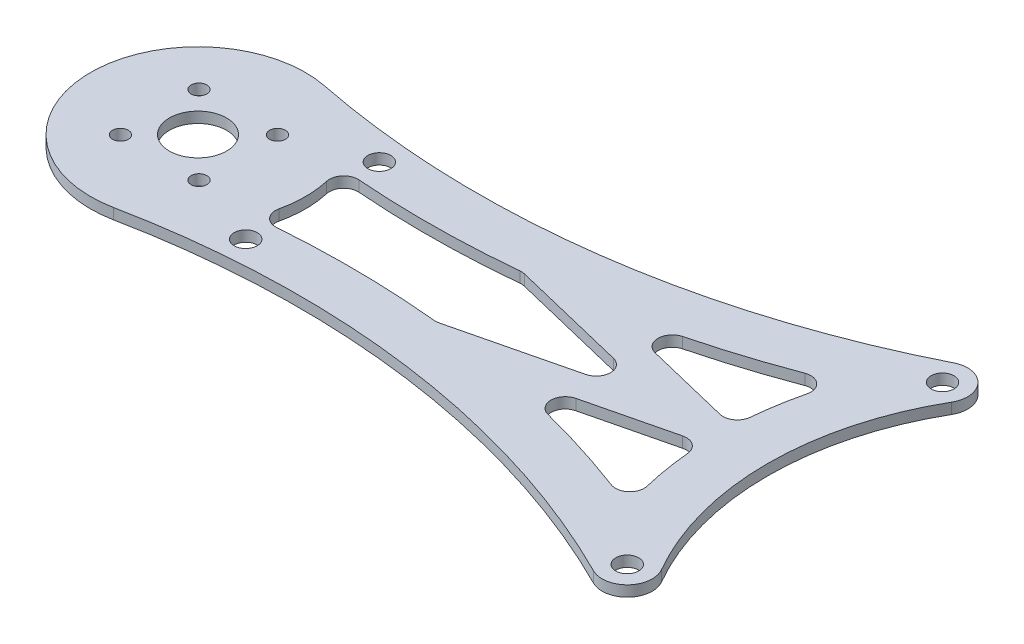
from build123d import *

# Parameters (mm, degrees)
SKETCH1_R                      = 3.5
BOSS_EXTRUDE1_DEPTH            = 0.75
F_2_2_2_2_DIAMETER_HOLE1_D     = 2.2
F_3_2_3_2_DIAMETER_HOLE1_D     = 3.2
F_3_2_3_2_DIAMETER_HOLE1_DEPTH = 10
F_3_2_3_2_DIAMETER_HOLE1_TIP   = 0.96137699
CUT_EXTRUDE1_DEPTH             = 138.395414771
FILLET1_R                      = 2
SKETCH7_R                      = 4
CUT_EXTRUDE2_DEPTH             = 138.395414889


with BuildPart() as part:
    # Sketch1 → Boss-Extrude1 (new, symmetric)
    with BuildSketch(Plane(origin=(0, 0, 0), x_dir=(1, 0, 0), z_dir=(0, 1, 0))):
        with BuildLine():
            ThreePointArc((-41.13620668, -23.75), (-47.5, 0), (-41.13620668, 23.75))
            ThreePointArc((-41.13620668, 23.75), (-40.506696415, 24.5460597), (-39.675258631, 25.128043744))
            ThreePointArc((-39.675258631, 25.128043744), (-77.494729166, 13.448582828), (-117.056517742, 14.708361982))
            ThreePointArc((-117.056517742, 14.708361982), (-135, 0), (-117.056517742, -14.708361982))
            ThreePointArc((-117.056517742, -14.708361982), (-77.494729166, -13.448582828), (-39.675258631, -25.128043744))
            ThreePointArc((-39.675258631, -25.128043744), (-40.506696415, -24.5460597), (-41.13620668, -23.75))
        make_face()
        with BuildLine():
            ThreePointArc((-35.074028853, 20.25), (-39.855117767, 18.968911087), (-41.13620668, 23.75))
            ThreePointArc((-41.13620668, 23.75), (-47.5, 0), (-41.13620668, -23.75))
            ThreePointArc((-41.13620668, -23.75), (-39.855117767, -18.968911087), (-35.074028853, -20.25))
            ThreePointArc((-35.074028853, -20.25), (-40.5, 0), (-35.074028853, 20.25))
        make_face()
        with Locations((-38.105117767, -22)):
            Circle(SKETCH1_R)
        with Locations((-38.105117767, 22)):
            Circle(SKETCH1_R)
    extrude(amount=BOSS_EXTRUDE1_DEPTH, both=True)

    # Ø2.2 (2.2) Diameter Hole1 (through all)
    with Locations(Plane(origin=(0, 0.75, 0), x_dir=(1, 0, 0), z_dir=(0, 1, 0))):
        with Locations((-125.378942435, 5.51463095), (-114.418787327, 5.51463095), (-114.418787327, -5.445524158), (-125.378942435, -5.445524158)):
            Hole(F_2_2_2_2_DIAMETER_HOLE1_D / 2)

    # Ø3.2 (3.2) Diameter Hole1
    with Locations(Plane(origin=(0, 0.75, 0), x_dir=(1, 0, 0), z_dir=(0, 1, 0))):
        with Locations((-38.105117767, 22), (-38.105117767, -22), (-104.021186711, 9.323493222), (-104.021186711, -9.323493222)):
            Hole(F_3_2_3_2_DIAMETER_HOLE1_D / 2, depth=F_3_2_3_2_DIAMETER_HOLE1_DEPTH)
            with Locations((0, 0, -(F_3_2_3_2_DIAMETER_HOLE1_DEPTH + F_3_2_3_2_DIAMETER_HOLE1_TIP / 2))):  # 118° drill point
                Cone(0, F_3_2_3_2_DIAMETER_HOLE1_D / 2, F_3_2_3_2_DIAMETER_HOLE1_TIP, mode=Mode.SUBTRACT)

    # Sketch6 → Cut-Extrude1 (cut, through all)
    with BuildSketch(Plane(origin=(0, 0.75, 0), x_dir=(1, 0, 0), z_dir=(0, 1, 0))):
        with BuildLine():
            Line((-80.72687621, -6.02009961), (-55.965778938, 0))
            Line((-55.965778938, 0), (-80.72687621, 6.02009961))
            ThreePointArc((-80.72687621, 6.02009961), (-93.493210894, 5.375258779), (-106.259702082, 6.016993695))
            ThreePointArc((-106.259702082, 6.016993695), (-105, 0), (-106.259702082, -6.016993695))
            ThreePointArc((-106.259702082, -6.016993695), (-93.493210894, -5.375258779), (-80.72687621, -6.02009961))
        make_face()
        with BuildLine():
            Line((-70.096059807, 7.551982097), (-47.45584926, 2.047528026))
            ThreePointArc((-47.45584926, 2.047528026), (-46.716397825, 8.592332297), (-45.078723321, 14.971930527))
            ThreePointArc((-45.078723321, 14.971930527), (-57.396315368, 10.61771767), (-70.096059807, 7.551982097))
        make_face()
        with BuildLine():
            ThreePointArc((-45.078723321, -14.971930527), (-46.716397825, -8.592332297), (-47.45584926, -2.047528026))
            Line((-47.45584926, -2.047528026), (-70.096059807, -7.551982097))
            ThreePointArc((-70.096059807, -7.551982097), (-57.396315368, -10.61771767), (-45.078723321, -14.971930527))
        make_face()
    extrude(amount=-CUT_EXTRUDE1_DEPTH, mode=Mode.SUBTRACT)

    # Fillet1
    fillet1_edges = [part.edges().sort_by_distance(p)[0] for p in [
        (-47.45584926, 0, 2.047528026),
        (-45.078723321, 0, 14.971930527),
        (-70.096059807, 0, 7.551982097),
        (-106.259702082, 0, 6.016993695),
        (-106.259702082, 0, -6.016993695),
        (-80.72687621, 0, -6.02009961),
        (-55.965778938, 0, 0),
        (-80.72687621, 0, 6.02009961),
        (-45.078723321, 0, -14.971930527),
        (-47.45584926, 0, -2.047528026),
        (-70.096059807, 0, -7.551982097),
    ]]
    fillet(fillet1_edges, radius=FILLET1_R)

    # Sketch7 → Cut-Extrude2 (cut, through all)
    with BuildSketch(Plane(origin=(0, 0.75, 0), x_dir=(1, 0, 0), z_dir=(0, 1, 0))):
        with Locations(Location((-120, 0, 0), (0, 0, 270))):
            Circle(SKETCH7_R)
    extrude(amount=-CUT_EXTRUDE2_DEPTH, mode=Mode.SUBTRACT)


solid = part.part
